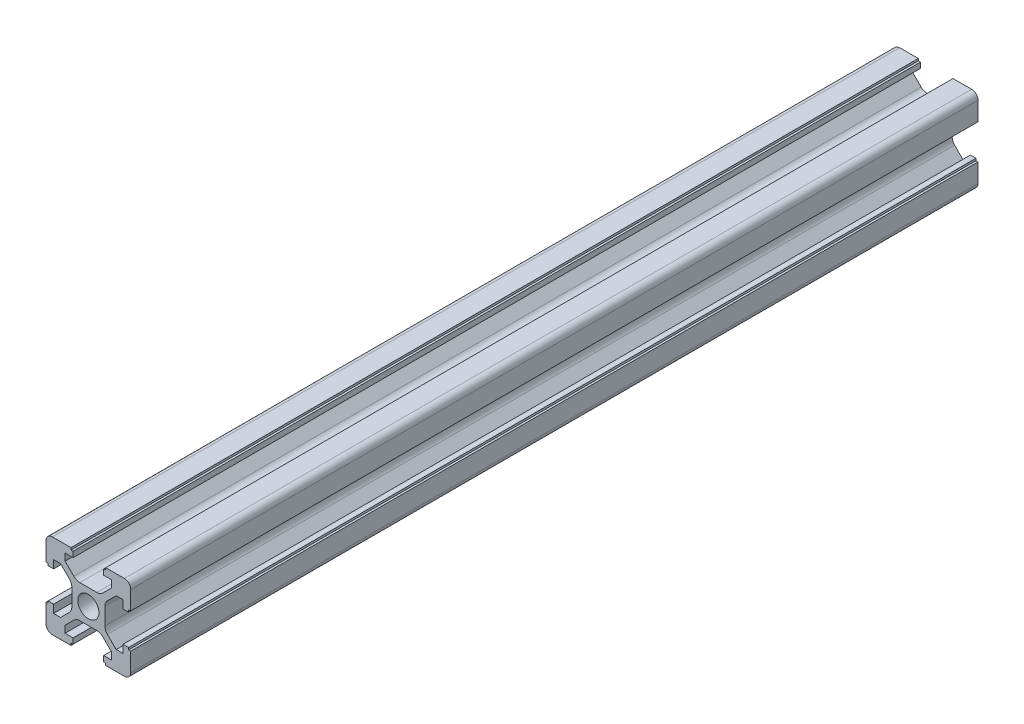
from build123d import *

# Parameters (mm, degrees)
SKETCH1_R           = 2.5
BOSS_EXTRUDE2_DEPTH = 200


with BuildPart() as part:
    # Sketch1 → Boss-Extrude2 (new body)
    with BuildSketch(Plane.XY):
        with BuildLine():
            Line((10, -4.1), (10, -8.5))
            ThreePointArc((10, -8.5), (9.560660172, -9.560660172), (8.5, -10))
            Line((8.5, -10), (4.1, -10))
            Line((4.1, -10), (4.1, -9.5))
            Line((4.1, -9.5), (3.6, -9.5))
            Line((3.6, -9.5), (3.6, -8.2))
            Line((3.6, -8.2), (5.5, -8.2))
            Line((5.5, -8.2), (5.5, -6.560660172))
            Line((5.5, -6.560660172), (3.425126266, -4.485786438))
            ThreePointArc((3.425126266, -4.485786438), (2.776279568, -4.052240935), (2.010912703, -3.9))
            Line((2.010912703, -3.9), (-2.010912703, -3.9))
            ThreePointArc((-2.010912703, -3.9), (-2.776279568, -4.052240935), (-3.425126266, -4.485786438))
            Line((-3.425126266, -4.485786438), (-5.5, -6.560660172))
            Line((-5.5, -6.560660172), (-5.5, -8.2))
            Line((-5.5, -8.2), (-3.6, -8.2))
            Line((-3.6, -8.2), (-3.6, -9.5))
            Line((-3.6, -9.5), (-4.1, -9.5))
            Line((-4.1, -9.5), (-4.1, -10))
            Line((-4.1, -10), (-8.5, -10))
            ThreePointArc((-8.5, -10), (-9.560660172, -9.560660172), (-10, -8.5))
            Line((-10, -8.5), (-10, -4.1))
            Line((-10, -4.1), (-9.5, -4.1))
            Line((-9.5, -4.1), (-9.5, -3.6))
            Line((-9.5, -3.6), (-8.2, -3.6))
            Line((-8.2, -3.6), (-8.2, -5.5))
            Line((-8.2, -5.5), (-6.560660172, -5.5))
            Line((-6.560660172, -5.5), (-4.485786438, -3.425126266))
            ThreePointArc((-4.485786438, -3.425126266), (-4.052240935, -2.776279568), (-3.9, -2.010912703))
            Line((-3.9, -2.010912703), (-3.9, 2.010912703))
            ThreePointArc((-3.9, 2.010912703), (-4.052240935, 2.776279568), (-4.485786438, 3.425126266))
            Line((-4.485786438, 3.425126266), (-6.560660172, 5.5))
            Line((-6.560660172, 5.5), (-8.2, 5.5))
            Line((-8.2, 5.5), (-8.2, 3.6))
            Line((-8.2, 3.6), (-9.5, 3.6))
            Line((-9.5, 3.6), (-9.5, 4.1))
            Line((-9.5, 4.1), (-10, 4.1))
            Line((-10, 4.1), (-10, 8.5))
            ThreePointArc((-10, 8.5), (-9.560660172, 9.560660172), (-8.5, 10))
            Line((-8.5, 10), (-4.1, 10))
            Line((-4.1, 10), (-4.1, 9.5))
            Line((-4.1, 9.5), (-3.6, 9.5))
            Line((-3.6, 9.5), (-3.6, 8.2))
            Line((-3.6, 8.2), (-5.5, 8.2))
            Line((-5.5, 8.2), (-5.5, 6.560660172))
            Line((-5.5, 6.560660172), (-3.425126266, 4.485786438))
            ThreePointArc((-3.425126266, 4.485786438), (-2.776279568, 4.052240935), (-2.010912703, 3.9))
            Line((-2.010912703, 3.9), (2.010912703, 3.9))
            ThreePointArc((2.010912703, 3.9), (2.776279568, 4.052240935), (3.425126266, 4.485786438))
            Line((3.425126266, 4.485786438), (5.5, 6.560660172))
            Line((5.5, 6.560660172), (5.5, 8.2))
            Line((5.5, 8.2), (3.6, 8.2))
            Line((3.6, 8.2), (3.6, 9.5))
            Line((3.6, 9.5), (4.1, 9.5))
            Line((4.1, 9.5), (4.1, 10))
            Line((4.1, 10), (8.5, 10))
            ThreePointArc((8.5, 10), (9.560660172, 9.560660172), (10, 8.5))
            Line((10, 8.5), (10, 4.1))
            Line((10, 4.1), (9.5, 4.1))
            Line((9.5, 4.1), (9.5, 3.6))
            Line((9.5, 3.6), (8.2, 3.6))
            Line((8.2, 3.6), (8.2, 5.5))
            Line((8.2, 5.5), (6.560660172, 5.5))
            Line((6.560660172, 5.5), (4.485786438, 3.425126266))
            ThreePointArc((4.485786438, 3.425126266), (4.052240935, 2.776279568), (3.9, 2.010912703))
            Line((3.9, 2.010912703), (3.9, -2.010912703))
            ThreePointArc((3.9, -2.010912703), (4.052240935, -2.776279568), (4.485786438, -3.425126266))
            Line((4.485786438, -3.425126266), (6.560660172, -5.5))
            Line((6.560660172, -5.5), (8.2, -5.5))
            Line((8.2, -5.5), (8.2, -3.6))
            Line((8.2, -3.6), (9.5, -3.6))
            Line((9.5, -3.6), (9.5, -4.1))
            Line((9.5, -4.1), (10, -4.1))
        make_face()
        Circle(SKETCH1_R, mode=Mode.SUBTRACT)
    extrude(amount=BOSS_EXTRUDE2_DEPTH)


solid = part.part
